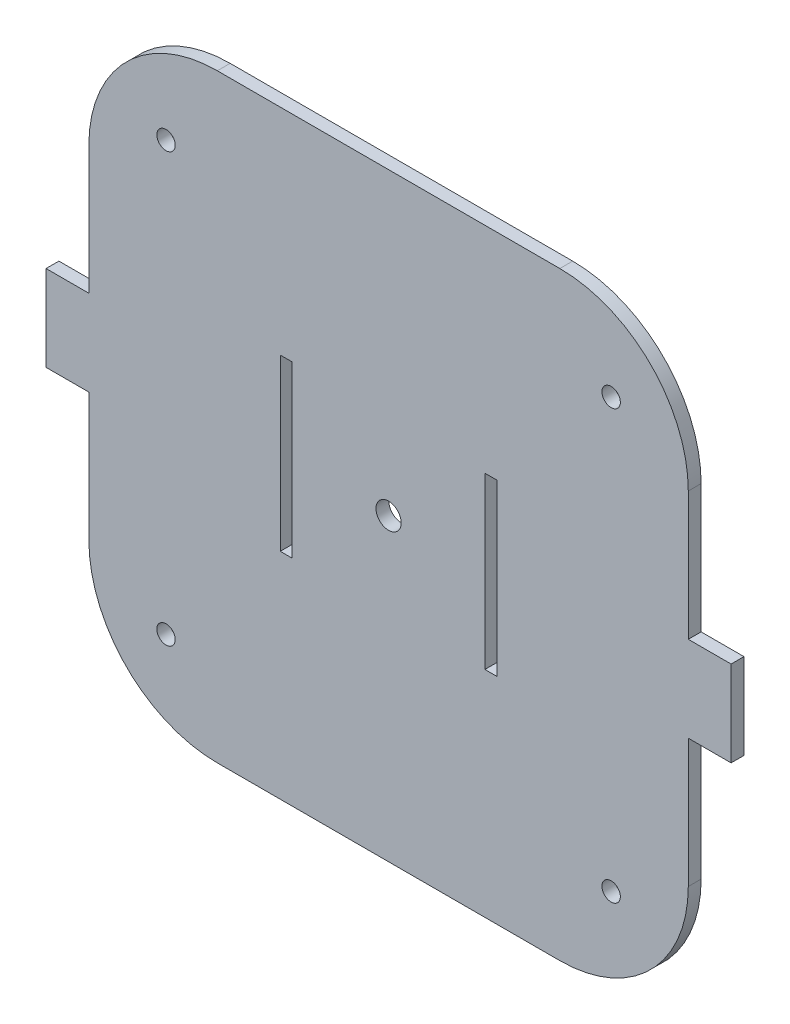
from build123d import *

# Parameters (mm, degrees)
CROQUIS2_R              = 2.95
CROQUIS2_R_2            = 2.15
SALIENTE_EXTRUIR2_DEPTH = 3


with BuildPart() as part:
    # Croquis2 → Saliente-Extruir2 (new body)
    with BuildSketch(Plane.XY):
        with BuildLine():
            Line((30, 110), (110, 110))
            ThreePointArc((110, 110), (131.213203436, 101.213203436), (140, 80))
            Line((140, 80), (140, 50))
            Line((140, 50), (150, 50))
            Line((150, 50), (150, 40))
            Line((150, 40), (150, 30))
            Line((150, 30), (140, 30))
            Line((140, 30), (140, 0))
            ThreePointArc((140, 0), (131.213203436, -21.213203436), (110, -30))
            Line((110, -30), (30, -30))
            ThreePointArc((30, -30), (8.786796564, -21.213203436), (0, 0))
            Line((0, 0), (0, 30))
            Line((0, 30), (-10, 30))
            Line((-10, 30), (-10, 40))
            Line((-10, 40), (-10, 50))
            Line((-10, 50), (0, 50))
            Line((0, 50), (0, 80))
            ThreePointArc((0, 80), (8.786796564, 101.213203436), (30, 110))
        make_face()
        with Locations((70, 40)):
            Circle(CROQUIS2_R, mode=Mode.SUBTRACT)
        with Locations((18.016709675, -10)):
            Circle(CROQUIS2_R_2, mode=Mode.SUBTRACT)
        with Locations(Location((18.016709675, 90, 0), (0, 0, 180))):
            Circle(CROQUIS2_R_2, mode=Mode.SUBTRACT)
        with Locations(Location((121.983290325, -10, 0), (0, 0, 180))):
            Circle(CROQUIS2_R_2, mode=Mode.SUBTRACT)
        with Locations((121.983290325, 90)):
            Circle(CROQUIS2_R_2, mode=Mode.SUBTRACT)
        Polygon((44.7, 59.85), (47.5, 59.85), (47.5, 40), (47.5, 20.15), (44.7, 20.15), align=None, mode=Mode.SUBTRACT)
        Polygon((92.5, 59.85), (92.5, 40), (92.5, 20.15), (95.3, 20.15), (95.3, 59.85), align=None, mode=Mode.SUBTRACT)
    extrude(amount=SALIENTE_EXTRUIR2_DEPTH)


solid = part.part
